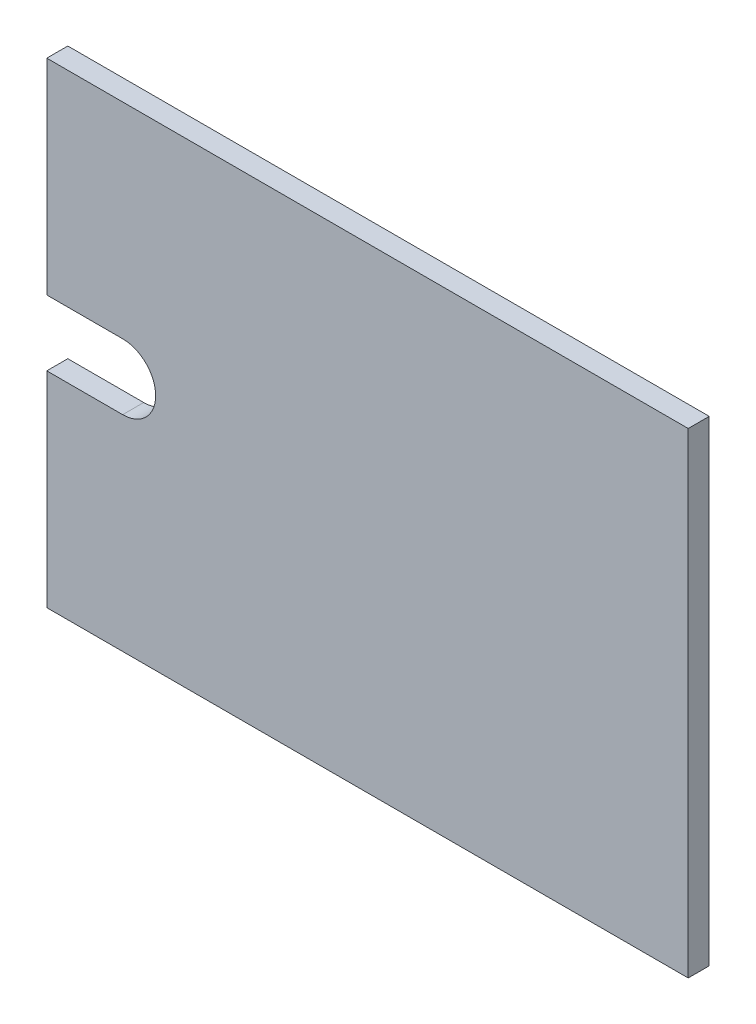
from build123d import *

# Parameters (mm, degrees)
SKETCH1_W           = 31
SKETCH1_H           = 23
BOSS_EXTRUDE1_DEPTH = 1.016
CUT_EXTRUDE1_DEPTH  = 20.326982589


with BuildPart() as part:
    # Sketch1 → Boss-Extrude1 (new body)
    with BuildSketch(Plane.XY):
        Rectangle(SKETCH1_W, SKETCH1_H)
    extrude(amount=BOSS_EXTRUDE1_DEPTH)

    # Sketch2 → Cut-Extrude1 (cut, through all)
    with BuildSketch(Plane(origin=(0, 0, 0), x_dir=(-1, 0, 0), z_dir=(0, 0, -1))):
        with BuildLine():
            Line((11.825, 1.5875), (15.5, 1.5875))
            Line((15.5, 1.5875), (15.5, -1.5875))
            Line((15.5, -1.5875), (11.831296781, -1.587487512))
            ThreePointArc((11.831296781, -1.587487512), (10.237503122, -0.003148397), (11.825, 1.5875))
        make_face()
    extrude(amount=-CUT_EXTRUDE1_DEPTH, mode=Mode.SUBTRACT)


solid = part.part
